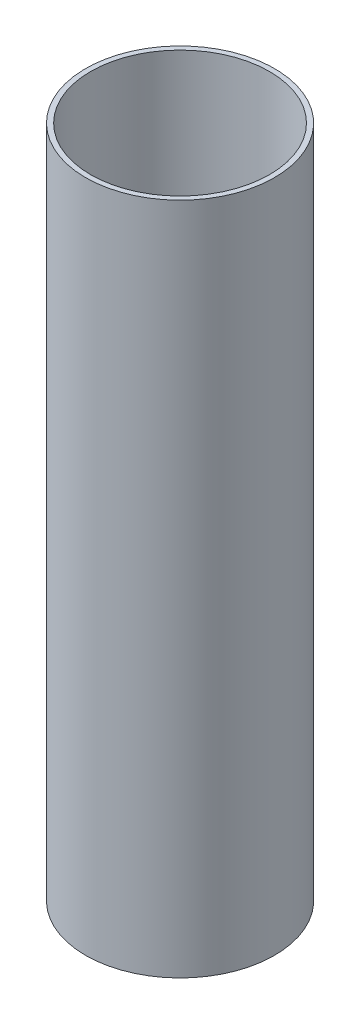
from build123d import *

# Parameters (mm, degrees)
SKETCH1_W = 1.524
SKETCH1_H = 203.2


with BuildPart() as part:
    # Sketch1 → Revolve1 (revolve)
    with BuildSketch(Plane.XY, mode=Mode.PRIVATE) as revolve1_sk:
        with Locations((27.7368, 101.6)):
            Rectangle(SKETCH1_W, SKETCH1_H)
    revolve(revolve1_sk.sketch.rotate(Axis((0, 307.012038368, 0), (0, -1, 0)), 90), axis=Axis((0, 307.012038368, 0), (0, -1, 0)))


solid = part.part
